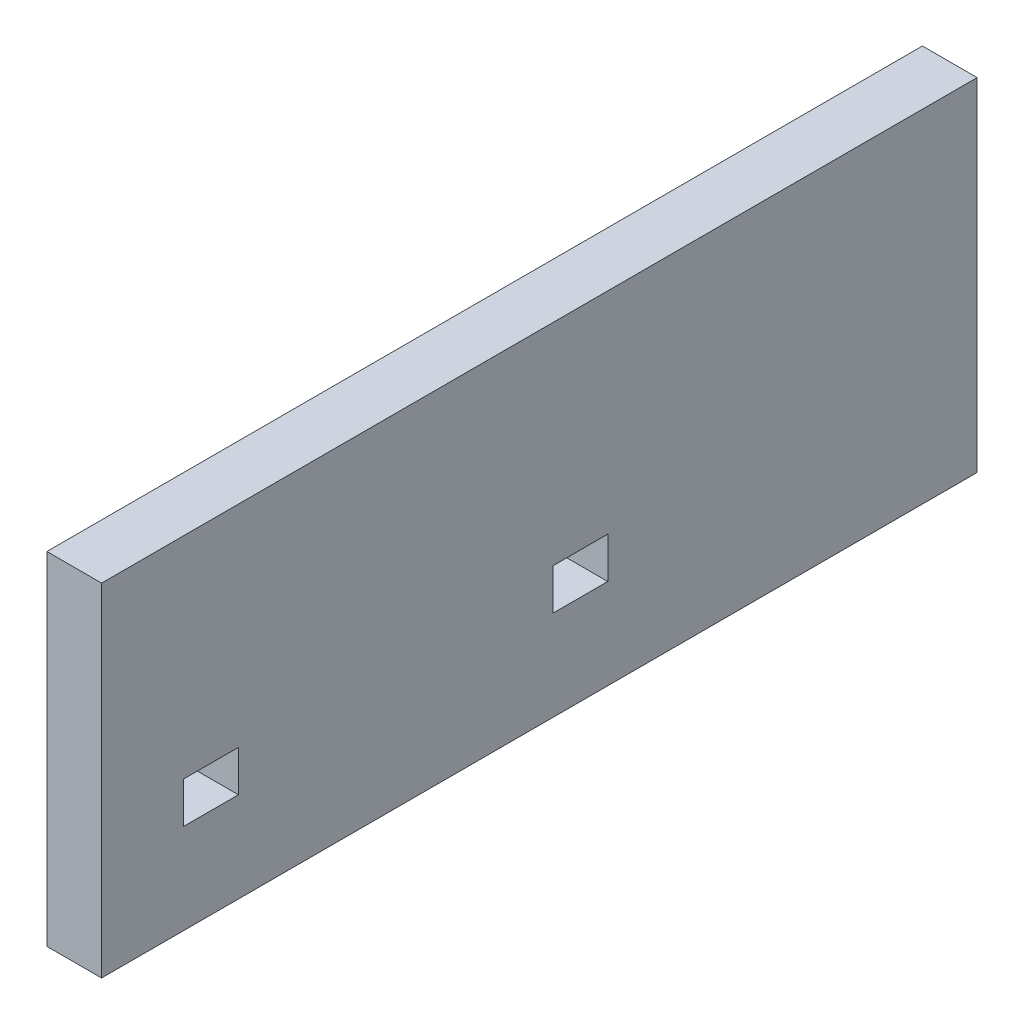
from build123d import *

# Parameters (mm, degrees)
SKETCH1_W           = 64
SKETCH1_H           = 25
BOSS_EXTRUDE1_DEPTH = 4
SKETCH2_W           = 4
SKETCH2_H           = 3
CUT_EXTRUDE1_DEPTH  = 6.54
SKETCH3_W           = 4
SKETCH3_H           = 3
CUT_EXTRUDE2_DEPTH  = 6.54
BOSS_EXTRUDE3_DEPTH = 0.4
BOSS_EXTRUDE4_DEPTH = 0.4


with BuildPart() as part:
    # Sketch1 → Boss-Extrude1 (new body)
    with BuildSketch(Plane(origin=(0, 0, 0), x_dir=(0, 0, -1), z_dir=(1, 0, 0))):
        with Locations((5.512195122, -0.487804878)):
            Rectangle(SKETCH1_W, SKETCH1_H)
    extrude(amount=BOSS_EXTRUDE1_DEPTH)

    # Sketch2 → Cut-Extrude1 (cut)
    with BuildSketch(Plane.ZY):
        with Locations((18.487816878, -4.887804878)):
            Rectangle(SKETCH2_W, SKETCH2_H)
    extrude(amount=-CUT_EXTRUDE1_DEPTH, mode=Mode.SUBTRACT)

    # Sketch3 → Cut-Extrude2 (cut)
    with BuildSketch(Plane.ZY):
        with Locations((-8.512195122, -4.887804878)):
            Rectangle(SKETCH3_W, SKETCH3_H)
    extrude(amount=-CUT_EXTRUDE2_DEPTH, mode=Mode.SUBTRACT)

    # Sketch6 → Boss-Extrude3 (add)
    # profile 1 of 4: a face of its own
    with BuildSketch(Plane.ZY):
        with BuildLine():
            Line((-10.162195122, -1.517351128), (-10.162195122, -2.223210503))
            Line((-10.162195122, -2.223210503), (-9.691882622, -2.223210503))
            add(Edge.make_bspline(
                [(-9.691882622, -2.223210503), (-9.683002587, -2.223395657), (-9.666219186, -2.223745599), (-9.642754561, -2.228365064), (-9.622309921, -2.235338467), (-9.605609534, -2.245859927), (-9.59228001, -2.25827413), (-9.582281833, -2.272302551), (-9.576653725, -2.288307203), (-9.575873045, -2.299406676), (-9.575476372, -2.305046441)],
                knots=[0, 0, 0, 0, 1.337253685, 2.527429943, 3.592906642, 4.576549477, 5.479646114, 6.326766664, 7.149811603, 8, 8, 8, 8], degree=3))
            add(Edge.make_bspline(
                [(-9.575476372, -2.305046441), (-9.575748577, -2.310834002), (-9.576279742, -2.322127502), (-9.582424571, -2.337995769), (-9.591710774, -2.352312243), (-9.605253792, -2.364228861), (-9.622006969, -2.374144146), (-9.642472917, -2.380743502), (-9.666044188, -2.385125407), (-9.682939978, -2.385508003), (-9.691882622, -2.385710503)],
                knots=[0, 0, 0, 0, 0.869374505, 1.696445304, 2.533268539, 3.423773422, 4.392964777, 5.452794053, 6.651808891, 8, 8, 8, 8], degree=3))
            Line((-9.691882622, -2.385710503), (-10.254187309, -2.385710503))
            add(Edge.make_bspline(
                [(-10.254187309, -2.385710503), (-10.260439589, -2.385653592), (-10.272504892, -2.385543768), (-10.289865257, -2.384204694), (-10.305834434, -2.381818362), (-10.320462065, -2.378744215), (-10.333839633, -2.374906418), (-10.345849796, -2.370040923), (-10.356445064, -2.36415747), (-10.365794392, -2.35744779), (-10.373961663, -2.34975762), (-10.380817444, -2.340796586), (-10.386723517, -2.330850613), (-10.391282133, -2.319732412), (-10.395435175, -2.307748858), (-10.397712768, -2.294436165), (-10.399356019, -2.280152931), (-10.399579812, -2.270286415), (-10.399695122, -2.265202691)],
                knots=[0, 0, 0, 0, 1.372871203, 2.649290895, 3.820039707, 4.916492466, 5.929911718, 6.872472131, 7.755691365, 8.585077687, 9.39412701, 10.209217855, 11.055198429, 11.92629904, 12.844136212, 13.833983162, 14.88395958, 16, 16, 16, 16], degree=3))
            Line((-10.399695122, -2.265202691), (-10.399695122, -1.517351128))
            add(Edge.make_bspline(
                [(-10.399695122, -1.517351128), (-10.399412884, -1.507995895), (-10.398878506, -1.490283069), (-10.392457085, -1.465706516), (-10.382498532, -1.444513462), (-10.367854368, -1.42749538), (-10.350028168, -1.414383224), (-10.32963717, -1.404730526), (-10.306609134, -1.399341689), (-10.290477672, -1.398596647), (-10.282116997, -1.398210503)],
                knots=[0, 0, 0, 0, 1.17897921, 2.232232259, 3.184893532, 4.112662188, 5.035459706, 5.962608428, 6.944053041, 8, 8, 8, 8], degree=3))
            add(Edge.make_bspline(
                [(-10.282116997, -1.398210503), (-10.273548796, -1.398470757), (-10.257115052, -1.398969921), (-10.23381068, -1.404933154), (-10.212937888, -1.414029911), (-10.194822646, -1.42709321), (-10.179972221, -1.444065756), (-10.169279188, -1.465085306), (-10.163328512, -1.490079058), (-10.162588802, -1.507878258), (-10.162195122, -1.517351128)],
                knots=[0, 0, 0, 0, 1.068304188, 2.04899909, 2.984936217, 3.899519172, 4.816415152, 5.777027299, 6.816916971, 8, 8, 8, 8], degree=3))
        make_face()
    # profile 2 of 4: a face of its own
    with BuildSketch(Plane.ZY):
        with BuildLine():
            Line((-8.664538872, -1.573210503), (-9.187195122, -1.573210503))
            Line((-9.187195122, -1.573210503), (-9.187195122, -1.810710503))
            Line((-9.187195122, -1.810710503), (-8.705945122, -1.810710503))
            add(Edge.make_bspline(
                [(-8.705945122, -1.810710503), (-8.697665275, -1.810985563), (-8.682054587, -1.811504156), (-8.660255761, -1.814946035), (-8.641755834, -1.821425567), (-8.626689263, -1.830448997), (-8.614797361, -1.841547028), (-8.606394632, -1.854563129), (-8.601226647, -1.869321402), (-8.600731867, -1.879743035), (-8.600476372, -1.885124566)],
                knots=[0, 0, 0, 0, 1.366436219, 2.576256398, 3.626274626, 4.580652776, 5.454544279, 6.285932958, 7.114888739, 8, 8, 8, 8], degree=3))
            add(Edge.make_bspline(
                [(-8.600476372, -1.885124566), (-8.60072643, -1.890508833), (-8.601210682, -1.900935764), (-8.606460714, -1.915675422), (-8.614615896, -1.928888322), (-8.6261995, -1.940380461), (-8.641242959, -1.949693217), (-8.659798107, -1.95623233), (-8.681769939, -1.960007267), (-8.697530616, -1.960465732), (-8.705945122, -1.960710503)],
                knots=[0, 0, 0, 0, 0.880249773, 1.7046525, 2.534781513, 3.41113233, 4.356774408, 5.414708965, 6.619732783, 8, 8, 8, 8], degree=3))
            Line((-8.705945122, -1.960710503), (-9.187195122, -1.960710503))
            Line((-9.187195122, -1.960710503), (-9.187195122, -2.235710503))
            Line((-9.187195122, -2.235710503), (-8.646570122, -2.235710503))
            add(Edge.make_bspline(
                [(-8.646570122, -2.235710503), (-8.638033493, -2.235994565), (-8.621912106, -2.236531015), (-8.599284083, -2.23987973), (-8.580131658, -2.246691154), (-8.564176093, -2.255546782), (-8.551787247, -2.266946928), (-8.542620342, -2.280063659), (-8.537409312, -2.295239245), (-8.536751218, -2.305854796), (-8.536413872, -2.311296441)],
                knots=[0, 0, 0, 0, 1.36504143, 2.577874981, 3.637584051, 4.597809526, 5.47414497, 6.305333936, 7.13129607, 8, 8, 8, 8], degree=3))
            add(Edge.make_bspline(
                [(-8.536413872, -2.311296441), (-8.536739444, -2.316613139), (-8.537370822, -2.326923756), (-8.542724994, -2.341659553), (-8.551843296, -2.354497701), (-8.564175989, -2.365862927), (-8.580092065, -2.374788491), (-8.599350686, -2.381221826), (-8.62188098, -2.384986152), (-8.638026487, -2.385459843), (-8.646570122, -2.385710503)],
                knots=[0, 0, 0, 0, 0.854466593, 1.657057916, 2.485926465, 3.368926319, 4.336454177, 5.400767872, 6.624577618, 8, 8, 8, 8], degree=3))
            Line((-8.646570122, -2.385710503), (-9.279187309, -2.385710503))
            add(Edge.make_bspline(
                [(-9.279187309, -2.385710503), (-9.285440665, -2.385661042), (-9.297508045, -2.385565593), (-9.314844942, -2.384128004), (-9.330853456, -2.382078168), (-9.345456974, -2.378918751), (-9.358849763, -2.375122939), (-9.370788504, -2.370188489), (-9.381499626, -2.36458256), (-9.390785087, -2.357823882), (-9.39897104, -2.35015622), (-9.405754517, -2.341214031), (-9.411779396, -2.331405463), (-9.416274009, -2.320312703), (-9.420409002, -2.308395568), (-9.422718149, -2.295219645), (-9.424362897, -2.281065061), (-9.42458166, -2.271263081), (-9.424695122, -2.266179253)],
                knots=[0, 0, 0, 0, 1.377123696, 2.65749712, 3.829856402, 4.929705443, 5.946263778, 6.891743789, 7.770823159, 8.602778521, 9.414333888, 10.231949491, 11.068220323, 11.942019184, 12.862699372, 13.841529285, 14.880502625, 16, 16, 16, 16], degree=3))
            Line((-9.424695122, -2.266179253), (-9.424695122, -1.542741753))
            add(Edge.make_bspline(
                [(-9.424695122, -1.542741753), (-9.424537165, -1.536021761), (-9.424236426, -1.523227342), (-9.421179201, -1.505025937), (-9.416663486, -1.488647657), (-9.409900546, -1.474160812), (-9.401299526, -1.461311149), (-9.390070245, -1.450734377), (-9.376971662, -1.44180088), (-9.361658815, -1.434718413), (-9.344106984, -1.429661415), (-9.324464048, -1.425652348), (-9.302533981, -1.423689931), (-9.287197924, -1.423375003), (-9.279187309, -1.423210503)],
                knots=[0, 0, 0, 0, 1.11062516, 2.114556653, 3.045094595, 3.912404228, 4.74887322, 5.586727783, 6.447054782, 7.36251211, 8.364188029, 9.462525625, 10.674579088, 12, 12, 12, 12], degree=3))
            Line((-9.279187309, -1.423210503), (-8.664538872, -1.423210503))
            add(Edge.make_bspline(
                [(-8.664538872, -1.423210503), (-8.655871153, -1.423487134), (-8.639617688, -1.424005864), (-8.616867849, -1.427395836), (-8.597798954, -1.434104219), (-8.582088104, -1.443038585), (-8.570272, -1.454487019), (-8.561086792, -1.467195433), (-8.556243349, -1.482132118), (-8.555528756, -1.49251711), (-8.555163872, -1.497819878)],
                knots=[0, 0, 0, 0, 1.397942636, 2.621383073, 3.690359872, 4.640841992, 5.509503561, 6.32471017, 7.144566092, 8, 8, 8, 8], degree=3))
            add(Edge.make_bspline(
                [(-8.555163872, -1.497819878), (-8.555519109, -1.503256066), (-8.556210734, -1.51384001), (-8.561143619, -1.529038336), (-8.57013306, -1.542098545), (-8.58211062, -1.553552245), (-8.597754803, -1.562561643), (-8.616916559, -1.568954074), (-8.639609242, -1.572438046), (-8.655868216, -1.572941839), (-8.664538872, -1.573210503)],
                knots=[0, 0, 0, 0, 0.871427345, 1.696618953, 2.524578564, 3.388408753, 4.333604417, 5.393196714, 6.609832536, 8, 8, 8, 8], degree=3))
        make_face()
    # profile 3 of 4: a face of its own
    with BuildSketch(Plane.ZY):
        with BuildLine():
            Line((-8.204187309, -1.423210503), (-7.900281059, -1.423210503))
            add(Edge.make_bspline(
                [(-7.900281059, -1.423210503), (-7.881201349, -1.423441518), (-7.844378576, -1.423887362), (-7.791302687, -1.427104801), (-7.742482751, -1.432800334), (-7.697409466, -1.440362472), (-7.655386683, -1.451384796), (-7.615669912, -1.466057988), (-7.577874155, -1.48477578), (-7.554551816, -1.500358873), (-7.542859184, -1.508171441)],
                knots=[0, 0, 0, 0, 1.225564279, 2.365270496, 3.413611163, 4.381654944, 5.298634522, 6.199732674, 7.097437727, 8, 8, 8, 8], degree=3))
            add(Edge.make_bspline(
                [(-7.542859184, -1.508171441), (-7.535498609, -1.51368302), (-7.520895419, -1.524617848), (-7.500388594, -1.542413871), (-7.481335631, -1.56132375), (-7.463556048, -1.581138906), (-7.44735069, -1.602162844), (-7.43235891, -1.624036936), (-7.419152097, -1.64727115), (-7.40697324, -1.671382361), (-7.39647292, -1.69668871), (-7.387289477, -1.722904216), (-7.379401211, -1.750132063), (-7.373202308, -1.778533123), (-7.368455199, -1.807956462), (-7.364525589, -1.838352652), (-7.362755562, -1.869869106), (-7.362384099, -1.891243044), (-7.362195122, -1.902116753)],
                knots=[0, 0, 0, 0, 0.977448636, 1.939232571, 2.883901233, 3.830090285, 4.767452304, 5.704354167, 6.647068068, 7.606707444, 8.574723332, 9.557671191, 10.558875218, 11.586715932, 12.646165863, 13.727106023, 14.84369506, 16, 16, 16, 16], degree=3))
            add(Edge.make_bspline(
                [(-7.362195122, -1.902116753), (-7.362424726, -1.91638117), (-7.362873048, -1.944233602), (-7.366244941, -1.985132969), (-7.371798781, -2.024099648), (-7.379828089, -2.061241075), (-7.39018976, -2.096496583), (-7.402798347, -2.13002114), (-7.418192474, -2.161668292), (-7.435955588, -2.191643466), (-7.456409805, -2.219901505), (-7.479439499, -2.246580841), (-7.50499084, -2.271949417), (-7.523901816, -2.287175163), (-7.533484184, -2.294890191)],
                knots=[0, 0, 0, 0, 1.152813529, 2.250961987, 3.314370669, 4.332022999, 5.319390579, 6.282008453, 7.22337971, 8.160106925, 9.094792337, 10.038807076, 11.006245243, 12, 12, 12, 12], degree=3))
            add(Edge.make_bspline(
                [(-7.533484184, -2.294890191), (-7.541348912, -2.300350568), (-7.557051022, -2.311252337), (-7.582076233, -2.325461173), (-7.60804743, -2.338251163), (-7.635261797, -2.349116946), (-7.663465196, -2.35846215), (-7.692583291, -2.366518365), (-7.722778201, -2.372969038), (-7.75415298, -2.37782005), (-7.787080228, -2.381263746), (-7.821799215, -2.383771916), (-7.858599911, -2.385355615), (-7.883808077, -2.385590017), (-7.896765434, -2.385710503)],
                knots=[0, 0, 0, 0, 0.904236796, 1.805329577, 2.715946504, 3.637776338, 4.57149519, 5.522122391, 6.490945537, 7.487113656, 8.520349644, 9.618217477, 10.775729707, 12, 12, 12, 12], degree=3))
            Line((-7.896765434, -2.385710503), (-8.201648247, -2.385710503))
            add(Edge.make_bspline(
                [(-8.201648247, -2.385710503), (-8.211620926, -2.385578457), (-8.230320512, -2.385330858), (-8.256385838, -2.382119902), (-8.278717466, -2.377556538), (-8.29731697, -2.37056072), (-8.31231904, -2.361331242), (-8.324520351, -2.350702902), (-8.333945392, -2.338362514), (-8.340540417, -2.324135463), (-8.344593889, -2.308076535), (-8.347421759, -2.290086883), (-8.349471667, -2.27000113), (-8.349618266, -2.255833413), (-8.349695122, -2.248405816)],
                knots=[0, 0, 0, 0, 1.504704713, 2.821444018, 3.959027339, 4.939262919, 5.804084666, 6.604866066, 7.36960536, 8.130291012, 8.955318782, 9.861866685, 10.879057729, 12, 12, 12, 12], degree=3))
            Line((-8.349695122, -2.248405816), (-8.349695122, -1.542741753))
            add(Edge.make_bspline(
                [(-8.349695122, -1.542741753), (-8.349572223, -1.537660209), (-8.349335264, -1.527862629), (-8.347815674, -1.513664633), (-8.345068076, -1.500601787), (-8.341404907, -1.488509586), (-8.336497637, -1.477587202), (-8.330664815, -1.467643825), (-8.323491239, -1.459015331), (-8.31541403, -1.451280246), (-8.306067827, -1.444484059), (-8.295245524, -1.438963189), (-8.283285252, -1.434077672), (-8.270051321, -1.429901135), (-8.255454755, -1.426869267), (-8.239520851, -1.424797146), (-8.222312587, -1.423355268), (-8.210375447, -1.423259927), (-8.204187309, -1.423210503)],
                knots=[0, 0, 0, 0, 1.121149883, 2.161656868, 3.144768613, 4.062434499, 4.943280027, 5.780785291, 6.597337133, 7.41009045, 8.243273874, 9.136330531, 10.08320618, 11.091696065, 12.19316861, 13.36725843, 14.635203458, 16, 16, 16, 16], degree=3))
        make_face()
        with BuildLine():
            Line((-8.112195122, -1.573210503), (-8.112195122, -2.235710503))
            Line((-8.112195122, -2.235710503), (-7.936218559, -2.235710503))
            add(Edge.make_bspline(
                [(-7.936218559, -2.235710503), (-7.927103986, -2.235656454), (-7.909850566, -2.235554141), (-7.885561117, -2.235242808), (-7.864396721, -2.234466326), (-7.840153131, -2.233031846), (-7.811265815, -2.228942742), (-7.782957905, -2.221939848), (-7.760491798, -2.214334343), (-7.744569557, -2.207311805), (-7.729694421, -2.199357436), (-7.720727417, -2.192968792), (-7.716296684, -2.189812066)],
                knots=[0, 0, 0, 0, 1.195696755, 2.263392548, 3.186396068, 3.973788795, 5.448523528, 7.006194404, 7.792149986, 8.556987393, 9.28698556, 10, 10, 10, 10], degree=3))
            add(Edge.make_bspline(
                [(-7.716296684, -2.189812066), (-7.706920108, -2.182479811), (-7.68814993, -2.167801989), (-7.664534452, -2.140433146), (-7.644214422, -2.109764282), (-7.62774182, -2.075164985), (-7.615182089, -2.036797903), (-7.606067997, -1.994789841), (-7.600561667, -1.949007815), (-7.599991175, -1.917236905), (-7.599695122, -1.900749566)],
                knots=[0, 0, 0, 0, 0.879940482, 1.761478732, 2.663040415, 3.599230707, 4.590556212, 5.647242716, 6.779049494, 8, 8, 8, 8], degree=3))
            add(Edge.make_bspline(
                [(-7.599695122, -1.900749566), (-7.599841353, -1.889092388), (-7.600125145, -1.866469259), (-7.602412132, -1.833655707), (-7.606497684, -1.803131185), (-7.612130414, -1.774868183), (-7.619276775, -1.74884615), (-7.628053753, -1.725105001), (-7.638362455, -1.703542538), (-7.650638437, -1.68447083), (-7.663726977, -1.667119924), (-7.677888308, -1.6517364), (-7.692560775, -1.637744003), (-7.707984905, -1.625356326), (-7.724289122, -1.614839594), (-7.741223622, -1.605713164), (-7.758943017, -1.598284574), (-7.784152325, -1.590740411), (-7.817938457, -1.583713735), (-7.861442279, -1.57745605), (-7.908876967, -1.573788821), (-7.941811095, -1.573407877), (-7.958874809, -1.573210503)],
                knots=[0, 0, 0, 0, 1.231277093, 2.389544192, 3.472021302, 4.482180662, 5.431545237, 6.319334831, 7.152834168, 7.950320432, 8.710928362, 9.445987813, 10.156211497, 10.85108737, 11.532041973, 12.202745024, 12.880915949, 13.557411168, 14.979123138, 16.521579505, 18.197772947, 20, 20, 20, 20], degree=3))
            Line((-7.958874809, -1.573210503), (-8.112195122, -1.573210503))
        make_face(mode=Mode.SUBTRACT)
    # profile 4 of 4: a face of its own
    with BuildSketch(Plane.ZY):
        with BuildLine():
            Line((-6.837195122, -2.292351128), (-6.837195122, -1.698210503))
            add(Edge.make_bspline(
                [(-6.837195122, -1.698210503), (-6.853041822, -1.708039064), (-6.883122069, -1.726695662), (-6.92657284, -1.75230602), (-6.966102103, -1.773703805), (-7.001501041, -1.791518361), (-7.032856757, -1.805266739), (-7.060177382, -1.815261379), (-7.083517882, -1.821689812), (-7.097973853, -1.822743411), (-7.104382622, -1.823210503)],
                knots=[0, 0, 0, 0, 1.505300314, 2.857364845, 4.070812878, 5.133181927, 6.055847417, 6.832198635, 7.482278372, 8, 8, 8, 8], degree=3))
            add(Edge.make_bspline(
                [(-7.104382622, -1.823210503), (-7.109749924, -1.822964449), (-7.12025951, -1.822482657), (-7.135579529, -1.818127644), (-7.149836373, -1.811053874), (-7.162799645, -1.801500883), (-7.173925264, -1.79031593), (-7.181815793, -1.777501998), (-7.187154296, -1.763981621), (-7.187702355, -1.754509059), (-7.187976372, -1.749773003)],
                knots=[0, 0, 0, 0, 1.048472332, 2.05298836, 3.08994209, 4.147431551, 5.192570346, 6.15407508, 7.077081503, 8, 8, 8, 8], degree=3))
            add(Edge.make_bspline(
                [(-7.187976372, -1.749773003), (-7.187721626, -1.744456263), (-7.187238235, -1.734367514), (-7.182348877, -1.720357677), (-7.174366365, -1.708531919), (-7.162337194, -1.699257916), (-7.146765206, -1.690692871), (-7.127082647, -1.680961458), (-7.102483769, -1.670321708), (-7.084475062, -1.662953904), (-7.074695122, -1.658952691)],
                knots=[0, 0, 0, 0, 0.817245481, 1.550759111, 2.25817608, 2.985825094, 3.86757028, 4.999132776, 6.370327093, 8, 8, 8, 8], degree=3))
            add(Edge.make_bspline(
                [(-7.074695122, -1.658952691), (-7.059657213, -1.652719257), (-7.030845676, -1.640776453), (-6.990518118, -1.621322183), (-6.955017438, -1.601225842), (-6.923777495, -1.580417703), (-6.895856701, -1.558492681), (-6.869964547, -1.535675376), (-6.845499732, -1.511806482), (-6.826963429, -1.490772219), (-6.812898577, -1.474448922), (-6.803614333, -1.463191462), (-6.79494741, -1.453479374), (-6.787340589, -1.444876444), (-6.780755356, -1.437470098), (-6.775060279, -1.431310976), (-6.77023162, -1.426568965), (-6.765094733, -1.42143106), (-6.757535201, -1.416674657), (-6.746161497, -1.413083914), (-6.732054517, -1.411131567), (-6.721706816, -1.410858452), (-6.716101372, -1.410710503)],
                knots=[0, 0, 0, 0, 2.18787787, 4.191814332, 6.01429899, 7.667193259, 9.232196314, 10.782375135, 12.304686998, 13.822893245, 14.549034552, 15.20116279, 15.784023712, 16.298563377, 16.744790376, 17.116279894, 17.425682649, 17.654724294, 18.091672851, 18.609180754, 19.246580467, 20, 20, 20, 20], degree=3))
            add(Edge.make_bspline(
                [(-6.716101372, -1.410710503), (-6.709497669, -1.411055552), (-6.696810776, -1.411718452), (-6.678636149, -1.416609452), (-6.662814919, -1.425455594), (-6.649056547, -1.437332899), (-6.638117539, -1.452314662), (-6.630166396, -1.469987155), (-6.625481358, -1.490223297), (-6.624965401, -1.50456496), (-6.624695122, -1.512077691)],
                knots=[0, 0, 0, 0, 1.028556973, 1.976041815, 2.902164252, 3.829674388, 4.787258963, 5.76777786, 6.830673738, 8, 8, 8, 8], degree=3))
            Line((-6.624695122, -1.512077691), (-6.624695122, -2.265788628))
            add(Edge.make_bspline(
                [(-6.624695122, -2.265788628), (-6.625029287, -2.276158795), (-6.625657731, -2.295661364), (-6.630320656, -2.322940842), (-6.638673442, -2.346136747), (-6.650585103, -2.365279679), (-6.665938162, -2.380438752), (-6.685017857, -2.39105637), (-6.707415332, -2.397030404), (-6.723356429, -2.397804212), (-6.731726372, -2.398210503)],
                knots=[0, 0, 0, 0, 1.279590211, 2.406451085, 3.400472696, 4.303279562, 5.166944604, 6.034004115, 6.967745169, 8, 8, 8, 8], degree=3))
            add(Edge.make_bspline(
                [(-6.731726372, -2.398210503), (-6.739304039, -2.3978669), (-6.753848071, -2.397207411), (-6.774594834, -2.39235196), (-6.792918881, -2.383798002), (-6.808823282, -2.371968239), (-6.821822944, -2.35671687), (-6.830815813, -2.337945433), (-6.836416212, -2.316174559), (-6.836925686, -2.300591975), (-6.837195122, -2.292351128)],
                knots=[0, 0, 0, 0, 1.072034071, 2.05758567, 2.993292679, 3.914690909, 4.843156799, 5.799149092, 6.836080361, 8, 8, 8, 8], degree=3))
        make_face()
    extrude(amount=BOSS_EXTRUDE3_DEPTH)

    # Sketch7 → Boss-Extrude4 (add)
    # profile 1 of 4: a face of its own
    with BuildSketch(Plane.ZY):
        with BuildLine():
            Line((16.859866747, -1.696958666), (16.859866747, -2.402818041))
            Line((16.859866747, -2.402818041), (17.293460497, -2.402818041))
            add(Edge.make_bspline(
                [(17.293460497, -2.402818041), (17.301626724, -2.403001821), (17.317059319, -2.403349131), (17.338649963, -2.408002482), (17.357527443, -2.415041338), (17.372991609, -2.425534505), (17.385335081, -2.437965959), (17.394458898, -2.452059124), (17.399674005, -2.467962679), (17.400345022, -2.479018497), (17.40068706, -2.484653978)],
                knots=[0, 0, 0, 0, 1.292617516, 2.442798032, 3.485803584, 4.468013706, 5.3806317, 6.248526192, 7.107221329, 8, 8, 8, 8], degree=3))
            add(Edge.make_bspline(
                [(17.40068706, -2.484653978), (17.400361858, -2.490424423), (17.399730904, -2.501620197), (17.394415335, -2.517571745), (17.38566009, -2.531691004), (17.373399149, -2.543785978), (17.357977866, -2.553704412), (17.339064207, -2.560350011), (17.317293248, -2.564718994), (17.301688032, -2.565111238), (17.293460497, -2.565318041)],
                knots=[0, 0, 0, 0, 0.914623225, 1.774544987, 2.638188297, 3.530147283, 4.488101837, 5.525201818, 6.695212545, 8, 8, 8, 8], degree=3))
            Line((17.293460497, -2.565318041), (16.782522997, -2.565318041))
            add(Edge.make_bspline(
                [(16.782522997, -2.565318041), (16.777246688, -2.565262333), (16.76706517, -2.565154835), (16.752369389, -2.563794161), (16.738866215, -2.56144044), (16.726507473, -2.558351765), (16.715233094, -2.554437938), (16.705042868, -2.549671846), (16.696175497, -2.543638692), (16.685533835, -2.534783743), (16.674694968, -2.520234537), (16.666149954, -2.498694901), (16.660608768, -2.473145652), (16.660125053, -2.454674095), (16.659866747, -2.444810228)],
                knots=[0, 0, 0, 0, 0.952275579, 1.837574526, 2.660697622, 3.424636545, 4.13459382, 4.81270699, 5.448342597, 6.065342205, 7.306484748, 8.670733462, 10.222161641, 12, 12, 12, 12], degree=3))
            Line((16.659866747, -2.444810228), (16.659866747, -1.696958666))
            add(Edge.make_bspline(
                [(16.659866747, -1.696958666), (16.660175302, -1.687622808), (16.660756694, -1.670031814), (16.665766388, -1.645499927), (16.674137644, -1.624516396), (16.686239242, -1.607351303), (16.701326604, -1.594183538), (16.718545715, -1.584417343), (16.738125431, -1.578960052), (16.751826618, -1.57820652), (16.758890185, -1.577818041)],
                knots=[0, 0, 0, 0, 1.276258148, 2.404776506, 3.407189413, 4.346345669, 5.24879646, 6.126059677, 7.03390116, 8, 8, 8, 8], degree=3))
            add(Edge.make_bspline(
                [(16.758890185, -1.577818041), (16.766096386, -1.578088932), (16.780038191, -1.578613025), (16.79975674, -1.584572565), (16.817403291, -1.593859786), (16.832661402, -1.607013769), (16.845344326, -1.623904715), (16.853697579, -1.645062778), (16.859077878, -1.66973616), (16.859592218, -1.687485121), (16.859866747, -1.696958666)],
                knots=[0, 0, 0, 0, 0.973967595, 1.884330731, 2.764730739, 3.659693951, 4.593368858, 5.598036214, 6.717946931, 8, 8, 8, 8], degree=3))
        make_face()
    # profile 2 of 4: a face of its own
    with BuildSketch(Plane.ZY):
        with BuildLine():
            Line((18.216702685, -1.752818041), (17.734866747, -1.752818041))
            Line((17.734866747, -1.752818041), (17.734866747, -1.990318041))
            Line((17.734866747, -1.990318041), (18.178616747, -1.990318041))
            add(Edge.make_bspline(
                [(18.178616747, -1.990318041), (18.186246949, -1.990590928), (18.200631465, -1.991105376), (18.220755766, -1.994586033), (18.23783443, -2.001074674), (18.251740894, -2.010118181), (18.262584346, -2.021312292), (18.270382658, -2.034251458), (18.275037981, -2.0489957), (18.275594083, -2.059359436), (18.275882372, -2.064732103)],
                knots=[0, 0, 0, 0, 1.323593457, 2.495248788, 3.524918328, 4.47080182, 5.349302931, 6.20530668, 7.069612702, 8, 8, 8, 8], degree=3))
            add(Edge.make_bspline(
                [(18.275882372, -2.064732103), (18.275572911, -2.070097772), (18.274977076, -2.080428829), (18.270606466, -2.095305032), (18.262706957, -2.10827729), (18.252251122, -2.119926206), (18.238347649, -2.129260305), (18.221213405, -2.135803489), (18.200918106, -2.139623265), (18.18638196, -2.140076124), (18.178616747, -2.140318041)],
                knots=[0, 0, 0, 0, 0.924458141, 1.779951211, 2.640140796, 3.521726366, 4.458495826, 5.49614413, 6.66243969, 8, 8, 8, 8], degree=3))
            Line((18.178616747, -2.140318041), (17.734866747, -2.140318041))
            Line((17.734866747, -2.140318041), (17.734866747, -2.415318041))
            Line((17.734866747, -2.415318041), (18.233304247, -2.415318041))
            add(Edge.make_bspline(
                [(18.233304247, -2.415318041), (18.241194226, -2.415589412), (18.256030458, -2.416099695), (18.276942924, -2.41960651), (18.294698745, -2.426219964), (18.309373855, -2.435296641), (18.320771021, -2.446634021), (18.328979954, -2.459862658), (18.334095264, -2.474852616), (18.334605059, -2.485459331), (18.334866747, -2.490903978)],
                knots=[0, 0, 0, 0, 1.32615547, 2.493688384, 3.546365583, 4.49046101, 5.372470781, 6.222617986, 7.087632813, 8, 8, 8, 8], degree=3))
            add(Edge.make_bspline(
                [(18.334866747, -2.490903978), (18.334616388, -2.496223312), (18.334131593, -2.506523627), (18.32888438, -2.521078328), (18.320716845, -2.534031475), (18.309372966, -2.545326904), (18.294740346, -2.554472859), (18.276872522, -2.560713005), (18.256063928, -2.564631403), (18.241201716, -2.565079782), (18.233304247, -2.565318041)],
                knots=[0, 0, 0, 0, 0.897763696, 1.73842254, 2.586071082, 3.475188159, 4.426891182, 5.484203335, 6.663158263, 8, 8, 8, 8], degree=3))
            Line((18.233304247, -2.565318041), (17.657522997, -2.565318041))
            add(Edge.make_bspline(
                [(17.657522997, -2.565318041), (17.652245462, -2.56526958), (17.642061576, -2.565176068), (17.627392869, -2.563719477), (17.61384429, -2.561698389), (17.601512954, -2.558527291), (17.590222559, -2.554652147), (17.580109608, -2.549829333), (17.571116849, -2.544054484), (17.560549962, -2.535147506), (17.549741725, -2.520676893), (17.541139224, -2.499289948), (17.535610151, -2.473928032), (17.535125598, -2.455585466), (17.534866747, -2.445786791)],
                knots=[0, 0, 0, 0, 0.955653574, 1.844092931, 2.668196909, 3.434845744, 4.147321441, 4.827840074, 5.459264264, 6.078452548, 7.32399778, 8.682221344, 10.227628701, 12, 12, 12, 12], degree=3))
            Line((17.534866747, -2.445786791), (17.534866747, -1.722349291))
            add(Edge.make_bspline(
                [(17.534866747, -1.722349291), (17.535005426, -1.715637711), (17.535268928, -1.702885094), (17.537542545, -1.684648969), (17.541696, -1.668443082), (17.547027314, -1.653814547), (17.554545733, -1.641262762), (17.56367841, -1.630367026), (17.574825306, -1.621543429), (17.58774665, -1.614378436), (17.602657116, -1.609263126), (17.619254503, -1.605295904), (17.637813144, -1.603285897), (17.650748319, -1.602978852), (17.657522997, -1.602818041)],
                knots=[0, 0, 0, 0, 1.216349958, 2.311176214, 3.321466233, 4.244082852, 5.122395137, 5.959470175, 6.807206914, 7.684011774, 8.624639293, 9.655058628, 10.771858517, 12, 12, 12, 12], degree=3))
            Line((17.657522997, -1.602818041), (18.216702685, -1.602818041))
            add(Edge.make_bspline(
                [(18.216702685, -1.602818041), (18.224722602, -1.603085196), (18.239688733, -1.603583741), (18.26067803, -1.607075358), (18.278302186, -1.613720629), (18.292786641, -1.622801431), (18.303882973, -1.634041832), (18.311831904, -1.647069512), (18.316644075, -1.66173365), (18.317199793, -1.672117892), (18.317483935, -1.677427416)],
                knots=[0, 0, 0, 0, 1.36007704, 2.538067639, 3.58985368, 4.53308381, 5.415222125, 6.242608656, 7.101435667, 8, 8, 8, 8], degree=3))
            add(Edge.make_bspline(
                [(18.317483935, -1.677427416), (18.317209683, -1.682870166), (18.316676436, -1.693452916), (18.311771993, -1.708386364), (18.304018376, -1.721746154), (18.292765515, -1.733006809), (18.278347935, -1.742157657), (18.260627361, -1.748493765), (18.23969738, -1.752074241), (18.224725619, -1.752558526), (18.216702685, -1.752818041)],
                knots=[0, 0, 0, 0, 0.915102895, 1.779303728, 2.620624594, 3.497553256, 4.435212944, 5.476921449, 6.647955179, 8, 8, 8, 8], degree=3))
        make_face()
    # profile 3 of 4: a face of its own
    with BuildSketch(Plane.ZY):
        with BuildLine():
            Line((18.645022997, -1.602818041), (18.92803081, -1.602818041))
            add(Edge.make_bspline(
                [(18.92803081, -1.602818041), (18.945743735, -1.603049123), (18.979965421, -1.603495577), (19.029334769, -1.606721868), (19.074777285, -1.612397087), (19.116793703, -1.620011261), (19.155980213, -1.630987771), (19.193014538, -1.645734374), (19.22823506, -1.664423125), (19.249810865, -1.679970045), (19.260647997, -1.687778978)],
                knots=[0, 0, 0, 0, 1.214949748, 2.347304501, 3.391395739, 4.354815671, 5.273696524, 6.177577939, 7.0846308, 8, 8, 8, 8], degree=3))
            add(Edge.make_bspline(
                [(19.260647997, -1.687778978), (19.267227567, -1.693299922), (19.280333731, -1.704297359), (19.298673789, -1.722104503), (19.315779518, -1.740947729), (19.331558227, -1.760901041), (19.34624966, -1.781782252), (19.359607046, -1.803747442), (19.371505776, -1.826897621), (19.382207749, -1.851113382), (19.391822594, -1.87631353), (19.400020785, -1.902537914), (19.406835184, -1.929814398), (19.412477347, -1.958170406), (19.416992059, -1.987554884), (19.420030794, -2.018002656), (19.422101909, -2.049468861), (19.422277449, -2.070848401), (19.422366747, -2.081724291)],
                knots=[0, 0, 0, 0, 0.934074157, 1.860627617, 2.778151398, 3.700581759, 4.62597068, 5.553903444, 6.494638847, 7.455315794, 8.432582127, 9.42709432, 10.442221132, 11.489449333, 12.571167258, 13.674711989, 14.817113183, 16, 16, 16, 16], degree=3))
            add(Edge.make_bspline(
                [(19.422366747, -2.081724291), (19.422209352, -2.095988751), (19.421902066, -2.123837674), (19.418620775, -2.164707838), (19.413663332, -2.203646509), (19.406644048, -2.240782659), (19.39752478, -2.27606925), (19.386006706, -2.309498934), (19.372220067, -2.341131206), (19.356469338, -2.371152151), (19.338138309, -2.399332591), (19.317729484, -2.426175741), (19.294708463, -2.451336586), (19.277763395, -2.466747569), (19.269241747, -2.474497728)],
                knots=[0, 0, 0, 0, 1.177894576, 2.299638151, 3.384109959, 4.418655841, 5.418986714, 6.391664657, 7.335665777, 8.266543246, 9.188290802, 10.108892715, 11.048965213, 12, 12, 12, 12], degree=3))
            add(Edge.make_bspline(
                [(19.269241747, -2.474497728), (19.26202744, -2.479946633), (19.247689821, -2.490775715), (19.224791763, -2.505068177), (19.201006209, -2.517804357), (19.176136255, -2.52868031), (19.15036398, -2.538113019), (19.123693645, -2.546092607), (19.096041443, -2.552563613), (19.067333374, -2.557435914), (19.037199352, -2.560867912), (19.005408774, -2.563378619), (18.97173152, -2.564962912), (18.948670606, -2.565197493), (18.936819872, -2.565318041)],
                knots=[0, 0, 0, 0, 0.925322609, 1.838973863, 2.760470671, 3.685721242, 4.615762166, 5.569044426, 6.534370574, 7.521793176, 8.54874761, 9.638779778, 10.786596523, 12, 12, 12, 12], degree=3))
            Line((18.936819872, -2.565318041), (18.657913622, -2.565318041))
            add(Edge.make_bspline(
                [(18.657913622, -2.565318041), (18.648785953, -2.565186015), (18.63164117, -2.564938026), (18.607721935, -2.561708697), (18.587180556, -2.557173187), (18.570093143, -2.550089289), (18.556346529, -2.540868419), (18.545107303, -2.530281866), (18.536760328, -2.517805489), (18.53075786, -2.503676548), (18.527134009, -2.487646592), (18.524429227, -2.469690605), (18.522651305, -2.449597318), (18.522464647, -2.435439104), (18.522366747, -2.428013353)],
                knots=[0, 0, 0, 0, 1.440373713, 2.705498287, 3.805269499, 4.754377504, 5.607025678, 6.406896425, 7.176867404, 7.959908131, 8.817747891, 9.764402264, 10.827465764, 12, 12, 12, 12], degree=3))
            Line((18.522366747, -2.428013353), (18.522366747, -1.722349291))
            add(Edge.make_bspline(
                [(18.522366747, -1.722349291), (18.522630157, -1.712551676), (18.523123246, -1.694211097), (18.528602239, -1.668811013), (18.53739236, -1.647453892), (18.55062766, -1.630342764), (18.568342802, -1.617711762), (18.590094409, -1.60878486), (18.616208122, -1.603647793), (18.63497264, -1.603107451), (18.645022997, -1.602818041)],
                knots=[0, 0, 0, 0, 1.184156251, 2.216673413, 3.127237649, 3.957991997, 4.7980749, 5.730373234, 6.784378054, 8, 8, 8, 8], degree=3))
        make_face()
        with BuildLine():
            Line((18.722366747, -1.752818041), (18.722366747, -2.415318041))
            Line((18.722366747, -2.415318041), (18.88974956, -2.415318041))
            add(Edge.make_bspline(
                [(18.88974956, -2.415318041), (18.89840839, -2.415263528), (18.91481547, -2.415160236), (18.937868433, -2.414854812), (18.95799097, -2.414066158), (18.981067198, -2.412642658), (19.008604109, -2.408565477), (19.035530152, -2.401513456), (19.056894283, -2.393939916), (19.072046248, -2.386928223), (19.086166612, -2.378903498), (19.094691825, -2.372568425), (19.098929247, -2.369419603)],
                knots=[0, 0, 0, 0, 1.189762513, 2.25440711, 3.167532091, 3.956548733, 5.430358016, 6.983860791, 7.773333673, 8.541799475, 9.275207434, 10, 10, 10, 10], degree=3))
            add(Edge.make_bspline(
                [(19.098929247, -2.369419603), (19.107831947, -2.362058296), (19.125756703, -2.347236989), (19.148420914, -2.320067098), (19.167446676, -2.289202411), (19.18318504, -2.254707681), (19.195104125, -2.216348598), (19.203912127, -2.174382121), (19.208884968, -2.12858862), (19.20953122, -2.096840431), (19.209866747, -2.080357103)],
                knots=[0, 0, 0, 0, 0.862158133, 1.735875088, 2.629960515, 3.566490817, 4.562401966, 5.626749914, 6.76783339, 8, 8, 8, 8], degree=3))
            add(Edge.make_bspline(
                [(19.209866747, -2.080357103), (19.209730974, -2.068698817), (19.209467477, -2.046073536), (19.207039513, -2.013291579), (19.203448673, -1.982756275), (19.198262231, -1.9544584), (19.191214012, -1.928498574), (19.182845029, -1.904776043), (19.173162657, -1.883180676), (19.161471287, -1.864094641), (19.148959338, -1.846810962), (19.135594995, -1.83135922), (19.121699284, -1.817372273), (19.107061267, -1.804983121), (19.09153836, -1.794452533), (19.075427162, -1.785379848), (19.058594578, -1.777850478), (19.0345857, -1.770406685), (19.00238662, -1.763286843), (18.961013092, -1.757101385), (18.915859375, -1.75337844), (18.884548571, -1.75300977), (18.868265185, -1.752818041)],
                knots=[0, 0, 0, 0, 1.263736723, 2.452538721, 3.561757639, 4.595853057, 5.568377371, 6.474747314, 7.321174707, 8.128562225, 8.896579552, 9.632295267, 10.34100519, 11.032350505, 11.707767174, 12.371389976, 13.035012777, 13.70241587, 15.092723896, 16.606016716, 18.234936978, 20, 20, 20, 20], degree=3))
            Line((18.868265185, -1.752818041), (18.722366747, -1.752818041))
        make_face(mode=Mode.SUBTRACT)
    # profile 4 of 4: a face of its own
    with BuildSketch(Plane.ZY):
        with BuildLine():
            Line((19.82412456, -2.415318041), (20.200101122, -2.415318041))
            add(Edge.make_bspline(
                [(20.200101122, -2.415318041), (20.208909423, -2.415475156), (20.225583208, -2.415772571), (20.248870471, -2.41974305), (20.269083868, -2.425747768), (20.285719815, -2.434809575), (20.298974103, -2.445998857), (20.308429191, -2.459300963), (20.314546492, -2.474454622), (20.315067197, -2.485310402), (20.315335497, -2.490903978)],
                knots=[0, 0, 0, 0, 1.365605266, 2.585039844, 3.655710943, 4.62353169, 5.504808848, 6.32361344, 7.136220807, 8, 8, 8, 8], degree=3))
            add(Edge.make_bspline(
                [(20.315335497, -2.490903978), (20.315102078, -2.495949469), (20.314644257, -2.505845518), (20.310156784, -2.519977196), (20.302855152, -2.532764732), (20.293164833, -2.544373691), (20.280372437, -2.55401594), (20.264448454, -2.560536614), (20.245819685, -2.564686442), (20.232418045, -2.565098875), (20.225296435, -2.565318041)],
                knots=[0, 0, 0, 0, 0.917766419, 1.800074687, 2.671698626, 3.589695302, 4.53930293, 5.560200141, 6.703494303, 8, 8, 8, 8], degree=3))
            Line((20.225296435, -2.565318041), (19.70068706, -2.565318041))
            add(Edge.make_bspline(
                [(19.70068706, -2.565318041), (19.692133125, -2.564987144), (19.675912694, -2.564359681), (19.652934342, -2.559491469), (19.632860227, -2.551145927), (19.616213391, -2.539311658), (19.602952867, -2.525396355), (19.593426545, -2.50995224), (19.587347673, -2.493291607), (19.58660746, -2.481709479), (19.586233935, -2.475864916)],
                knots=[0, 0, 0, 0, 1.266391716, 2.401400251, 3.4600877, 4.463520269, 5.405021064, 6.288311344, 7.136249128, 8, 8, 8, 8], degree=3))
            add(Edge.make_bspline(
                [(19.586233935, -2.475864916), (19.586486123, -2.471676645), (19.587038047, -2.462510436), (19.591196533, -2.448018322), (19.597246553, -2.431630075), (19.60550829, -2.414047561), (19.614993824, -2.396449649), (19.625682269, -2.380495786), (19.636221965, -2.36613355), (19.644271382, -2.358069088), (19.648147997, -2.354185228)],
                knots=[0, 0, 0, 0, 0.722554874, 1.581342, 2.587802234, 3.739514421, 4.931763347, 6.035407827, 7.053848667, 8, 8, 8, 8], degree=3))
            add(Edge.make_bspline(
                [(19.648147997, -2.354185228), (19.663663014, -2.339423699), (19.693732149, -2.310814872), (19.738163819, -2.27002605), (19.779987521, -2.232261804), (19.81362171, -2.203355829), (19.83885832, -2.182126859), (19.856036187, -2.167775491), (19.872037004, -2.155026555), (19.886422834, -2.143398548), (19.899568552, -2.133443736), (19.911276564, -2.124832549), (19.921600216, -2.117555127), (19.928148048, -2.113345495), (19.93115581, -2.111411791)],
                knots=[0, 0, 0, 0, 2.0654803, 4.003038382, 5.817254663, 7.500232794, 8.280109653, 8.998071024, 9.659043428, 10.253328382, 10.782061562, 11.249270872, 11.655150885, 12, 12, 12, 12], degree=3))
            add(Edge.make_bspline(
                [(19.93115581, -2.111411791), (19.940656628, -2.105053393), (19.959086107, -2.092719513), (19.98489526, -2.073352613), (20.008224926, -2.053981587), (20.029221856, -2.034624664), (20.047969664, -2.015159086), (20.063878666, -1.99508693), (20.078036207, -1.975223687), (20.089309116, -1.954837734), (20.098319494, -1.934507702), (20.105167553, -1.914441449), (20.108953339, -1.89436618), (20.109563803, -1.881087365), (20.109866747, -1.874497728)],
                knots=[0, 0, 0, 0, 1.333885468, 2.587441926, 3.763480281, 4.870969281, 5.918875184, 6.913165665, 7.857343738, 8.762030154, 9.625988496, 10.450042967, 11.230830797, 12, 12, 12, 12], degree=3))
            add(Edge.make_bspline(
                [(20.109866747, -1.874497728), (20.109613605, -1.867576312), (20.109116971, -1.853997334), (20.104898705, -1.834149105), (20.097827434, -1.815556574), (20.088151881, -1.798233446), (20.076213497, -1.782442044), (20.062268633, -1.768186956), (20.046089129, -1.756034316), (20.028077971, -1.746009173), (20.008890109, -1.73771223), (19.988493344, -1.732149419), (19.967357834, -1.728455183), (19.952916573, -1.728032121), (19.945608935, -1.727818041)],
                knots=[0, 0, 0, 0, 1.013394799, 1.988157578, 2.95730262, 3.918148904, 4.885461157, 5.850088455, 6.83076162, 7.838889423, 8.864779214, 9.885555642, 10.930038355, 12, 12, 12, 12], degree=3))
            add(Edge.make_bspline(
                [(19.945608935, -1.727818041), (19.93791388, -1.728035907), (19.922895162, -1.728461123), (19.901023099, -1.731989799), (19.880514609, -1.738124407), (19.861216789, -1.746568689), (19.843112894, -1.757410052), (19.826257525, -1.770582875), (19.810581304, -1.786102465), (19.801707421, -1.798068602), (19.797171435, -1.804185228)],
                knots=[0, 0, 0, 0, 1.060976744, 2.070746996, 3.045243965, 4.006242633, 4.96875046, 5.947705504, 6.950946439, 8, 8, 8, 8], degree=3))
            add(Edge.make_bspline(
                [(19.797171435, -1.804185228), (19.79568764, -1.806566737), (19.7919986, -1.812487692), (19.78701052, -1.82421553), (19.780014352, -1.839814686), (19.772910041, -1.859022897), (19.764954776, -1.879117204), (19.755522888, -1.897468448), (19.745779178, -1.913417898), (19.735530883, -1.927146228), (19.723249489, -1.938000731), (19.708498438, -1.945529377), (19.691315745, -1.950062251), (19.67903712, -1.950587781), (19.67256206, -1.950864916)],
                knots=[0, 0, 0, 0, 0.487387031, 1.211751485, 2.210815827, 3.461870546, 4.771792577, 5.966822704, 7.044588319, 8.02074229, 8.935682784, 9.86749156, 10.875434377, 12, 12, 12, 12], degree=3))
            add(Edge.make_bspline(
                [(19.67256206, -1.950864916), (19.666808128, -1.950619943), (19.655663161, -1.950145447), (19.639624368, -1.945943835), (19.625252553, -1.938760403), (19.612381841, -1.929234632), (19.601949619, -1.917024537), (19.594407032, -1.902610378), (19.589802907, -1.88623206), (19.589253914, -1.874659015), (19.58896831, -1.868638353)],
                knots=[0, 0, 0, 0, 1.047385763, 2.02871361, 2.994424813, 3.960208896, 4.927958695, 5.893888525, 6.904334659, 8, 8, 8, 8], degree=3))
            add(Edge.make_bspline(
                [(19.58896831, -1.868638353), (19.589218351, -1.860805027), (19.589726264, -1.844893104), (19.594391881, -1.820978584), (19.601192008, -1.796541795), (19.610969804, -1.771848608), (19.623527749, -1.74746986), (19.638941974, -1.723941158), (19.657154126, -1.701770754), (19.677935046, -1.680674566), (19.70172157, -1.661337473), (19.728371918, -1.643604422), (19.758238356, -1.628373921), (19.790774738, -1.61469964), (19.826422799, -1.603835428), (19.864974271, -1.595842257), (19.90649545, -1.591148348), (19.935114867, -1.590600946), (19.94990581, -1.590318041)],
                knots=[0, 0, 0, 0, 0.741729811, 1.506684154, 2.301733279, 3.143945637, 4.018799816, 4.896782053, 5.80461436, 6.734000583, 7.698707092, 8.705024536, 9.762070556, 10.871353558, 12.046361328, 13.288015715, 14.598406, 16, 16, 16, 16], degree=3))
            add(Edge.make_bspline(
                [(19.94990581, -1.590318041), (19.967570485, -1.590642614), (20.001644621, -1.591268698), (20.050605404, -1.597448016), (20.09562939, -1.607148486), (20.123251142, -1.617653689), (20.13662456, -1.622739916)],
                knots=[0, 0, 0, 0, 1.110900988, 2.142863791, 3.100844156, 4, 4, 4, 4], degree=3))
            add(Edge.make_bspline(
                [(20.13662456, -1.622739916), (20.144444344, -1.626508598), (20.159932983, -1.633973223), (20.181878964, -1.647593223), (20.202095121, -1.663461069), (20.220912926, -1.681110886), (20.238144706, -1.700339118), (20.253159948, -1.721389052), (20.266385854, -1.743770566), (20.277338534, -1.767502188), (20.286531628, -1.792039508), (20.292585792, -1.817376304), (20.29680962, -1.843040981), (20.297180751, -1.860352902), (20.297366747, -1.869028978)],
                knots=[0, 0, 0, 0, 1.005023787, 1.990649426, 2.984749335, 3.977102873, 4.975996678, 5.970125191, 6.967309536, 7.982803776, 8.994342131, 9.99664611, 10.995995278, 12, 12, 12, 12], degree=3))
            add(Edge.make_bspline(
                [(20.297366747, -1.869028978), (20.29718301, -1.875803316), (20.29681834, -1.889248638), (20.294922385, -1.909245751), (20.291367993, -1.928755072), (20.28645586, -1.947809863), (20.28023249, -1.96636725), (20.27253866, -1.984426048), (20.263550867, -2.002060203), (20.249859361, -2.02450103), (20.231674004, -2.050485792), (20.209097171, -2.078864732), (20.186444376, -2.103675101), (20.166561819, -2.121906792), (20.149420187, -2.135528587), (20.135124536, -2.147313685), (20.118551445, -2.160125205), (20.100344364, -2.174642731), (20.079961819, -2.190159465), (20.057803546, -2.207271061), (20.033728348, -2.225799387), (20.008065426, -2.244927951), (19.982724882, -2.264460289), (19.958693157, -2.28303982), (19.937014162, -2.300782714), (19.917180951, -2.316983844), (19.899916329, -2.332575735), (19.884330768, -2.346533742), (19.87104271, -2.359576578), (19.863155715, -2.368152823), (19.859476122, -2.372153978)],
                knots=[0, 0, 0, 0, 0.824995789, 1.637404858, 2.442822994, 3.236848502, 4.031467291, 4.823551656, 5.624745951, 6.439047715, 8.02226423, 9.483053739, 10.851843228, 12.108633375, 12.762293304, 13.517463167, 14.364258173, 15.312562146, 16.352634454, 17.483084895, 18.721314601, 20.051433906, 21.380040691, 22.616848719, 23.749603514, 24.790913554, 25.734234986, 26.581512168, 27.33821976, 28, 28, 28, 28], degree=3))
            add(Edge.make_bspline(
                [(19.859476122, -2.372153978), (19.85348955, -2.378624873), (19.840838411, -2.392299506), (19.829891399, -2.407375874), (19.82412456, -2.415318041)],
                knots=[0, 0, 0, 0, 0.946408428, 2, 2, 2, 2], degree=3))
        make_face()
    extrude(amount=BOSS_EXTRUDE4_DEPTH)


solid = part.part
